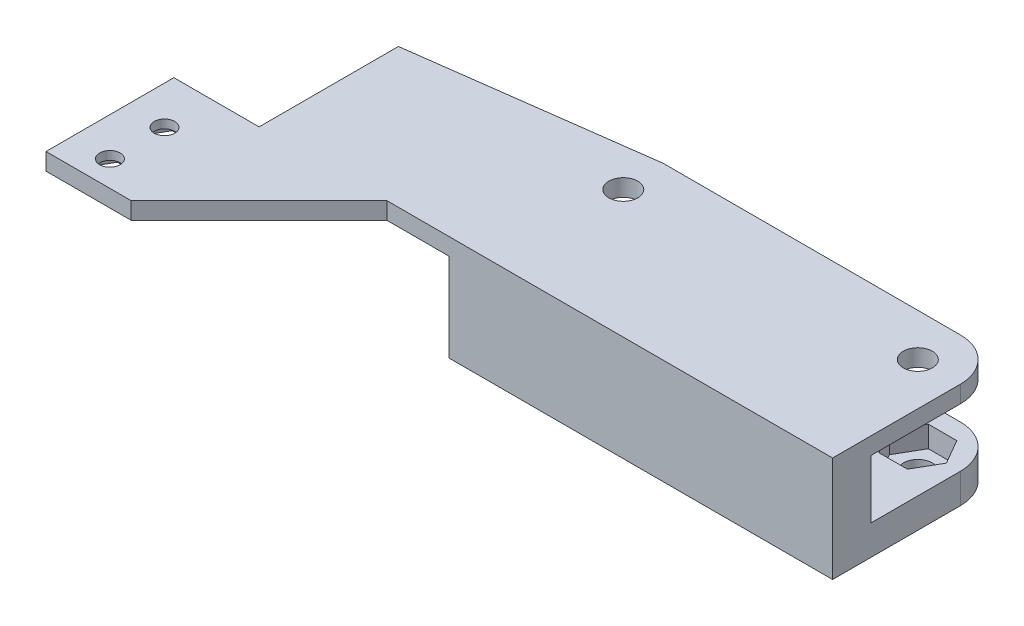
from build123d import *

# Parameters (mm, degrees)
SKETCH1_R           = 1.7
BOSS_EXTRUDE1_DEPTH = 2
SKETCH2_W           = 45
SKETCH2_H           = 4.5
BOSS_EXTRUDE2_DEPTH = 6.85
BOSS_EXTRUDE3_START = 3.5
BOSS_EXTRUDE3_DEPTH = 3.5
CUT_EXTRUDE1_DEPTH  = 2.5
CUT_EXTRUDE2_REACH  = 53.154
SKETCH4_R           = 1.2
CUT_EXTRUDE3_DEPTH  = 1
CUT_EXTRUDE4_REACH  = 53.154
SKETCH6_R           = 1.7


with BuildPart() as part:
    # Sketch1 → Boss-Extrude1 (new body)
    with BuildSketch(Plane(origin=(0, 0, 0), x_dir=(1, 0, 0), z_dir=(0, 1, 0))):
        with BuildLine():
            Line((34.55, 5), (0, 5))
            ThreePointArc((0, 5), (-0.332078478, 4.988960201), (-0.662690524, 4.955889554))
            Line((-0.662690524, 4.955889554), (-27.725, 1.337177748))
            Line((-27.725, 1.337177748), (-27.725, -15))
            Line((-27.725, -15), (-37.725, -15))
            Line((-37.725, -15), (-37.725, -30))
            Line((-37.725, -30), (-27.725, -30))
            Line((-27.725, -30), (-12.725, -15))
            Line((-12.725, -15), (39.55, -15))
            Line((39.55, -15), (39.55, 0))
            ThreePointArc((39.55, 0), (38.085533906, 3.535533906), (34.55, 5))
        make_face()
        Circle(SKETCH1_R, mode=Mode.SUBTRACT)
        with Locations((34.55, 0)):
            Circle(SKETCH1_R, mode=Mode.SUBTRACT)
    extrude(amount=BOSS_EXTRUDE1_DEPTH)

    # Sketch2 → Boss-Extrude2 (add)
    with BuildSketch(Plane.XZ):
        with Locations((17.05, 12.75)):
            Rectangle(SKETCH2_W, SKETCH2_H)
    extrude(amount=BOSS_EXTRUDE2_DEPTH)

    # Sketch3 → Boss-Extrude3 (add)
    with BuildSketch(Plane.XZ.offset(6.85).offset(BOSS_EXTRUDE3_START)):
        with BuildLine():
            Line((39.55, 0), (39.55, 15))
            Line((39.55, 15), (-5.45, 15))
            Line((-5.45, 15), (-5.45, -4.315741183))
            Line((-5.45, -4.315741183), (-0.662690524, -4.955889554))
            ThreePointArc((-0.662690524, -4.955889554), (-0.332078478, -4.988960201), (0, -5))
            Line((0, -5), (34.55, -5))
            ThreePointArc((34.55, -5), (38.085533906, -3.535533906), (39.55, 0))
        make_face()
    extrude(amount=-BOSS_EXTRUDE3_DEPTH)

    # Sketch3<3> → Cut-Extrude1 (cut)
    with BuildSketch(Plane.XZ.offset(6.85)):
        Polygon((37.898631561, 0), (36.224315781, 2.9), (32.875684219, 2.9), (31.201368439, 0), (32.875684219, -2.9), (36.224315781, -2.9), align=None)
        Polygon((3.348631561, 0), (1.674315781, 2.9), (-1.674315781, 2.9), (-3.348631561, 0), (-1.674315781, -2.9), (1.674315781, -2.9), align=None)
    extrude(amount=CUT_EXTRUDE1_DEPTH, mode=Mode.SUBTRACT)

    # Sketch4 → Cut-Extrude2 (cut, up to next)
    with BuildSketch(Plane(origin=(0, 2, 0), x_dir=(1, 0, 0), z_dir=(0, 1, 0)), mode=Mode.PRIVATE) as cut_extrude2_sk1:
        with Locations((-33.225, -20.6)):
            Circle(SKETCH4_R)
    cut_extrude2_tool1 = extrude(cut_extrude2_sk1.sketch, amount=-CUT_EXTRUDE2_REACH, mode=Mode.PRIVATE) & part.part
    # Sketch4 → Cut-Extrude2 (cut, up to next)
    with BuildSketch(Plane(origin=(0, 2, 0), x_dir=(1, 0, 0), z_dir=(0, 1, 0)), mode=Mode.PRIVATE) as cut_extrude2_sk2:
        with Locations((-33.225, -27)):
            Circle(SKETCH4_R)
    cut_extrude2_tool2 = extrude(cut_extrude2_sk2.sketch, amount=-CUT_EXTRUDE2_REACH, mode=Mode.PRIVATE) & part.part
    add(cut_extrude2_tool1.solids().sort_by_distance((-33.225, 2, 20.6))[0], mode=Mode.SUBTRACT)
    add(cut_extrude2_tool2.solids().sort_by_distance((-33.225, 2, 27))[0], mode=Mode.SUBTRACT)

    # Sketch5 → Cut-Extrude3 (cut)
    with BuildSketch(Plane.XZ):
        Polygon((-32.012564435, 22.7), (-34.437435565, 22.7), (-35.649871131, 20.6), (-34.437435565, 18.5), (-32.012564435, 18.5), (-30.800128869, 20.6), align=None)
        Polygon((-32.012564435, 29.1), (-34.437435565, 29.1), (-35.649871131, 27), (-34.437435565, 24.9), (-32.012564435, 24.9), (-30.800128869, 27), align=None)
    extrude(amount=-CUT_EXTRUDE3_DEPTH, mode=Mode.SUBTRACT)

    # Sketch6 → Cut-Extrude4 (cut, up to next)
    with BuildSketch(Plane.XZ.offset(10.35), mode=Mode.PRIVATE) as cut_extrude4_sk1:
        Circle(SKETCH6_R)
    cut_extrude4_tool1 = extrude(cut_extrude4_sk1.sketch, amount=-CUT_EXTRUDE4_REACH, mode=Mode.PRIVATE) & part.part
    # Sketch6 → Cut-Extrude4 (cut, up to next)
    with BuildSketch(Plane.XZ.offset(10.35), mode=Mode.PRIVATE) as cut_extrude4_sk2:
        with Locations((34.55, 0)):
            Circle(SKETCH6_R)
    cut_extrude4_tool2 = extrude(cut_extrude4_sk2.sketch, amount=-CUT_EXTRUDE4_REACH, mode=Mode.PRIVATE) & part.part
    add(cut_extrude4_tool1.solids().sort_by_distance((0, -10.35, 0))[0], mode=Mode.SUBTRACT)
    add(cut_extrude4_tool2.solids().sort_by_distance((34.55, -10.35, 0))[0], mode=Mode.SUBTRACT)


solid = part.part
